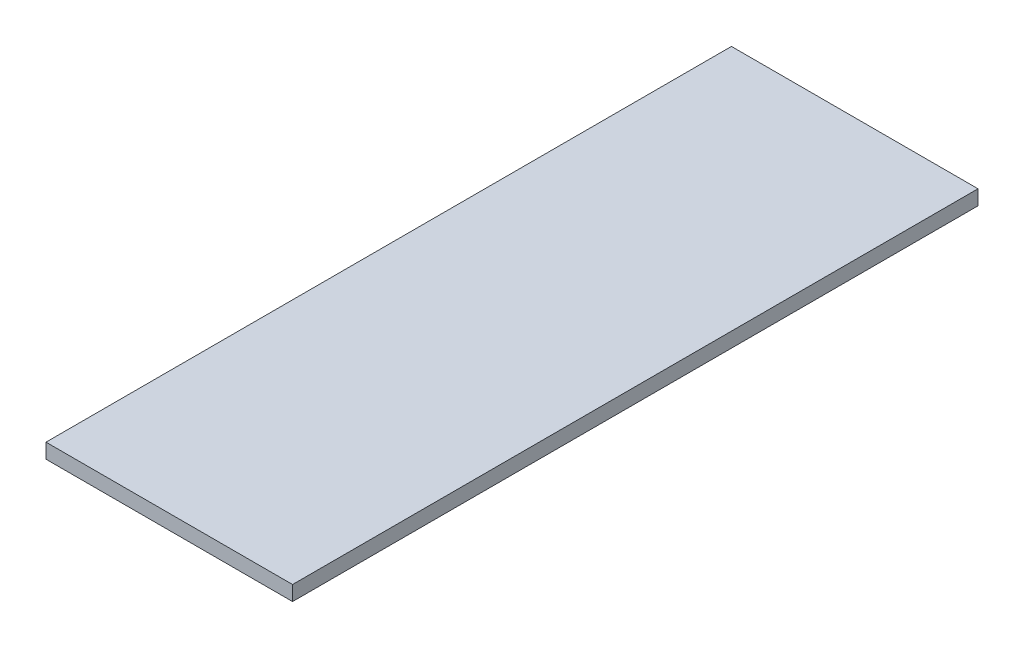
from build123d import *

# Parameters (mm, degrees)
SKETCH1_W           = 317.5
SKETCH1_H           = 882.65
BOSS_EXTRUDE1_DEPTH = 19.05


with BuildPart() as part:
    # Sketch1 → Boss-Extrude1 (new body)
    with BuildSketch(Plane(origin=(0, 0, 0), x_dir=(1, 0, 0), z_dir=(0, 1, 0))):
        Rectangle(SKETCH1_W, SKETCH1_H)
    extrude(amount=BOSS_EXTRUDE1_DEPTH)


solid = part.part
